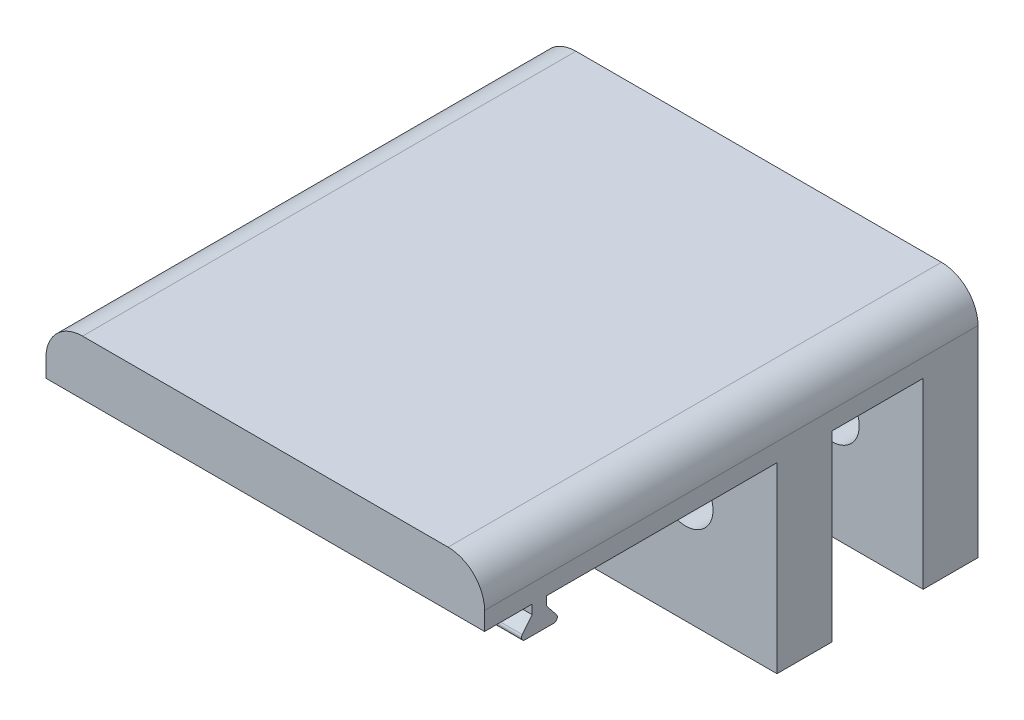
from build123d import *

# Parameters (mm, degrees)
EXTRUDE_START   = 2.5
SKETCH_1_W      = 24
SKETCH_1_H      = 10
SKETCH_1_R      = 1.5
EXTRUDE_1_DEPTH = 3
EXTRUDE_START_2 = -2.5
SKETCH_2_W      = 24
SKETCH_2_H      = 10
SKETCH_2_R      = 1.5
EXTRUDE_2_DEPTH = 3
SKETCH_3_W      = 24
SKETCH_3_H      = 11
EXTRUDE_3_DEPTH = 3
SKETCH_4_W      = 24
SKETCH_4_H      = 3
EXTRUDE_4_DEPTH = 16
EXTRUDE_5_DEPTH = 24
FILLET_1_R      = 0.2
FILLET_2_R      = 2


with BuildPart() as part:
    # 草图1 → 凸台-拉伸1 (new body)
    with BuildSketch(Plane.XY.offset(EXTRUDE_START)):
        Rectangle(SKETCH_1_W, SKETCH_1_H)
        with Locations((-7, 1)):
            Circle(SKETCH_1_R, mode=Mode.SUBTRACT)
        with Locations(Location((7, 1, 0), (0, 0, 180))):
            Circle(SKETCH_1_R, mode=Mode.SUBTRACT)
    extrude(amount=EXTRUDE_1_DEPTH)



with BuildPart() as body_2:
    # 草图2 → 凸台-拉伸2 (new body)
    with BuildSketch(Plane.XY.offset(EXTRUDE_START_2)):
        Rectangle(SKETCH_2_W, SKETCH_2_H)
        with Locations(Location((7, 1, 0), (0, 0, 180))):
            Circle(SKETCH_2_R, mode=Mode.SUBTRACT)
        with Locations((-7, 1)):
            Circle(SKETCH_2_R, mode=Mode.SUBTRACT)
    extrude(amount=-EXTRUDE_2_DEPTH)


with BuildPart() as part_1:
    add(part.part)

    add(body_2.part)  # 凸台-拉伸3 merges body 2
    # 草图3 → 凸台-拉伸3 (add)
    with BuildSketch(Plane(origin=(0, 5, 0), x_dir=(1, 0, 0), z_dir=(0, 1, 0))):
        Rectangle(SKETCH_3_W, SKETCH_3_H)
    extrude(amount=EXTRUDE_3_DEPTH)

    # 草图4 → 凸台-拉伸4 (add)
    with BuildSketch(Plane.XY.offset(5.5)):
        with Locations((0, 6.5)):
            Rectangle(SKETCH_4_W, SKETCH_4_H)
    extrude(amount=EXTRUDE_4_DEPTH)

    # 草图5 → 凸台-拉伸5 (add)
    with BuildSketch(Plane(origin=(12, 0, 0), x_dir=(0, 0, -1), z_dir=(1, 0, 0))):
        Polygon((-18.5, 5), (-17.3, 3.5), (-19.7, 3.5), align=None)
        Polygon((-18.9, 4.5), (-18.5, 5), (-18.9, 5), align=None)
        Polygon((-18.1, 5), (-18.5, 5), (-18.1, 4.5), align=None)
    extrude(amount=-EXTRUDE_5_DEPTH)

    # 圆角1
    fillet_1_edges = [part_1.edges().sort_by_distance(p)[0] for p in [
        (0, 3.5, 17.3),
        (0, 3.5, 19.7),
    ]]
    fillet(fillet_1_edges, radius=FILLET_1_R)

    # 圆角2
    fillet_2_edges = [part_1.edges().sort_by_distance(p)[0] for p in [
        (-12, 8, 8),
        (12, 8, 8),
    ]]
    fillet(fillet_2_edges, radius=FILLET_2_R)


solid = part_1.part
